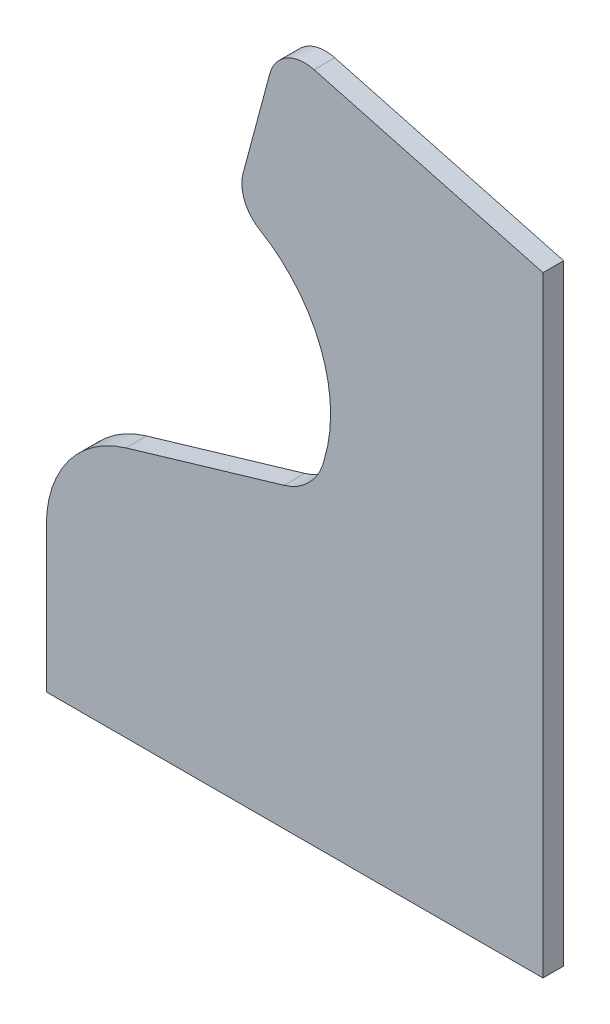
from build123d import *

# Parameters (mm, degrees)
SALIENTE_EXTRUIR1_DEPTH = 10


with BuildPart() as part:
    # Croquis1 → Saliente-Extruir1 (new body)
    with BuildSketch(Plane.XY):
        with BuildLine():
            Line((37.91601702, 121.421613069), (114.537816123, 144.025264418))
            ThreePointArc((114.537816123, 144.025264418), (127.193827362, 151.843476845), (134.121677329, 165.007973069))
            ThreePointArc((134.121677329, 165.007973069), (132.264993157, 210.622251423), (102.682371845, 245.392614983))
            ThreePointArc((102.682371845, 245.392614983), (95.369412387, 253.859995337), (94.665863515, 265.026056643))
            Line((94.665863515, 265.026056643), (107.60681577, 313.322347957))
            ThreePointArc((107.60681577, 313.322347957), (115.776254029, 323.968967178), (129.081215867, 325.720598634))
            Line((129.081215867, 325.720598634), (240, 296))
            Line((240, 296), (240, 0))
            Line((240, 0), (-0.665441115, -0.303814753))
            Line((-0.665441115, -0.303814753), (-0.665441115, 69.814722685))
            ThreePointArc((-0.665441115, 69.814722685), (10.046152069, 102.031954282), (37.91601702, 121.421613069))
        make_face()
    extrude(amount=SALIENTE_EXTRUIR1_DEPTH)


solid = part.part
